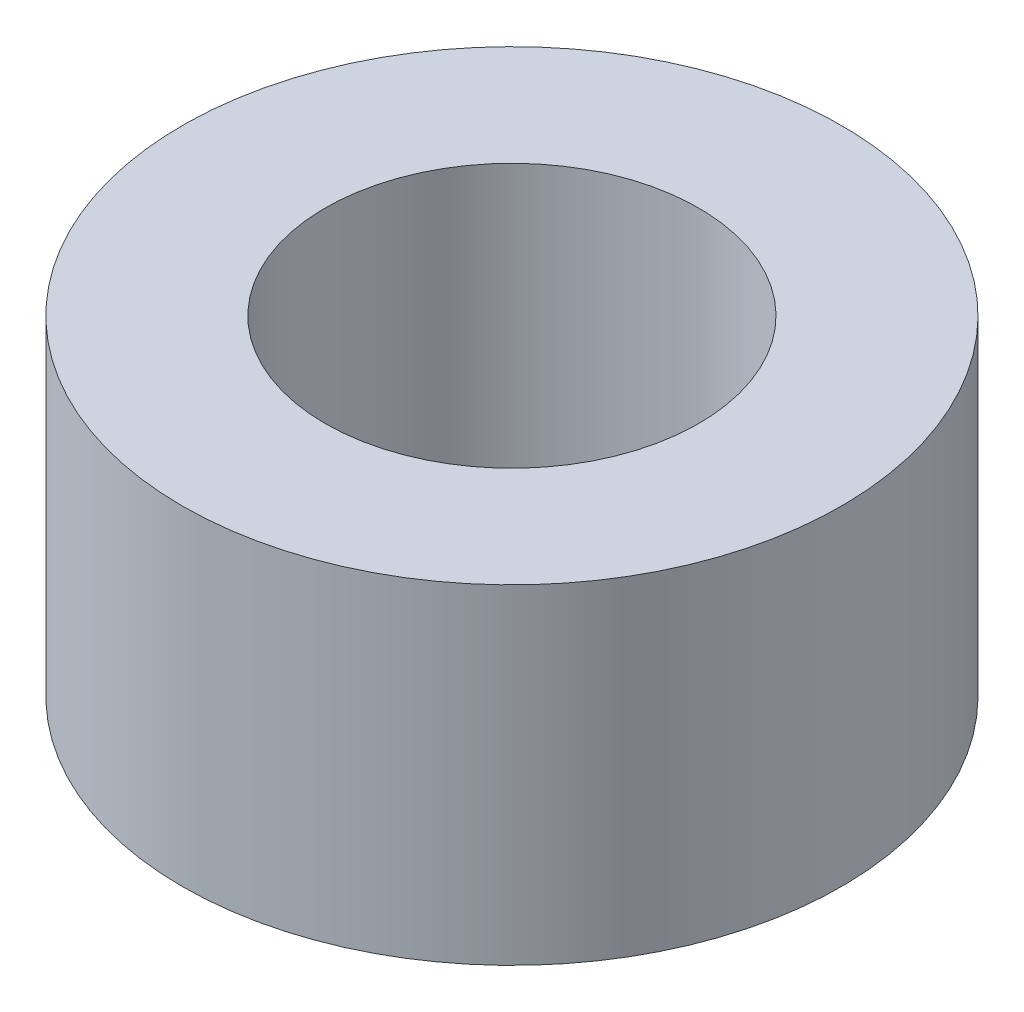
from build123d import *

# Parameters (mm, degrees)
SKETCH1_R           = 3
SKETCH1_R_2         = 1.7
BOSS_EXTRUDE1_DEPTH = 3


with BuildPart() as part:
    # Sketch1 → Boss-Extrude1 (new body)
    with BuildSketch(Plane(origin=(0, 0, 0), x_dir=(1, 0, 0), z_dir=(0, 1, 0))):
        with Locations(Location((0, 0, 0), (0, 0, 270))):
            Circle(SKETCH1_R)
        with Locations(Location((0, 0, 0), (0, 0, 270))):
            Circle(SKETCH1_R_2, mode=Mode.SUBTRACT)
    extrude(amount=BOSS_EXTRUDE1_DEPTH)


solid = part.part
